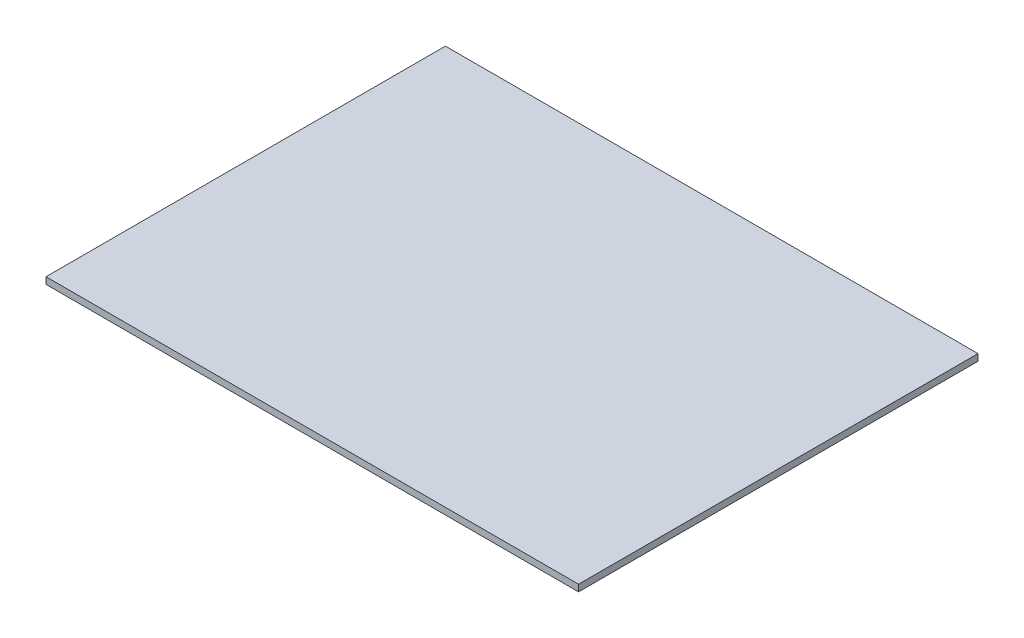
from build123d import *

# Parameters (mm, degrees)
SKETCH1_W           = 80
SKETCH1_H           = 60
BOSS_EXTRUDE1_DEPTH = 1


with BuildPart() as part:
    # Sketch1 → Boss-Extrude1 (new body)
    with BuildSketch(Plane(origin=(0, 0, 0), x_dir=(1, 0, 0), z_dir=(0, 1, 0))):
        Rectangle(SKETCH1_W, SKETCH1_H)
    extrude(amount=-BOSS_EXTRUDE1_DEPTH)


solid = part.part
